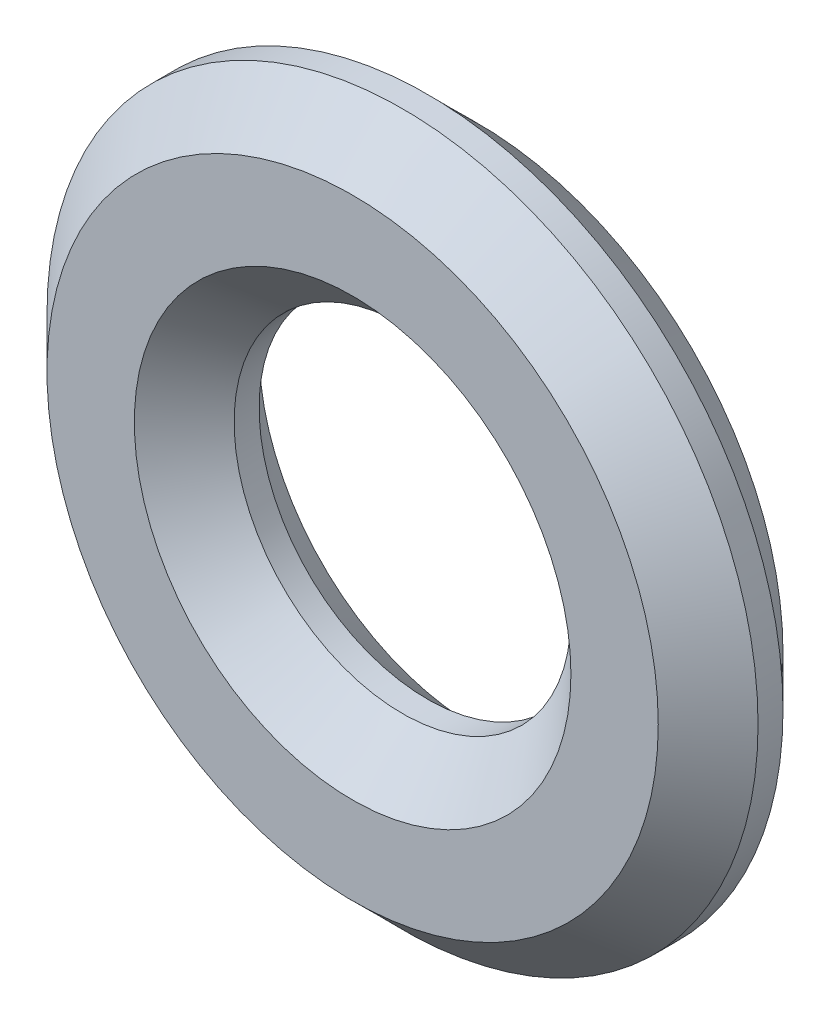
from build123d import *

# Parameters (mm, degrees)
ESBO_O1_R                = 5.7
ESBO_O1_R_2              = 2.7
RESSALTO_EXTRUS_O1_DEPTH = 2
CHANFRO1_SIZE            = 0.8


with BuildPart() as part:
    # Esboço1 → Ressalto-extrusão1 (new body)
    with BuildSketch(Plane.XY):
        Circle(ESBO_O1_R)
        Circle(ESBO_O1_R_2, mode=Mode.SUBTRACT)
    extrude(amount=RESSALTO_EXTRUS_O1_DEPTH)

    # Chanfro1
    chanfro1_edges = [part.edges().sort_by_distance(p)[0] for p in [
        (-5.7, 0, 0),
        (-5.7, 0, 2),
        (-2.7, 0, 0),
        (-2.7, 0, 2),
    ]]
    chamfer(chanfro1_edges, length=CHANFRO1_SIZE)


solid = part.part
